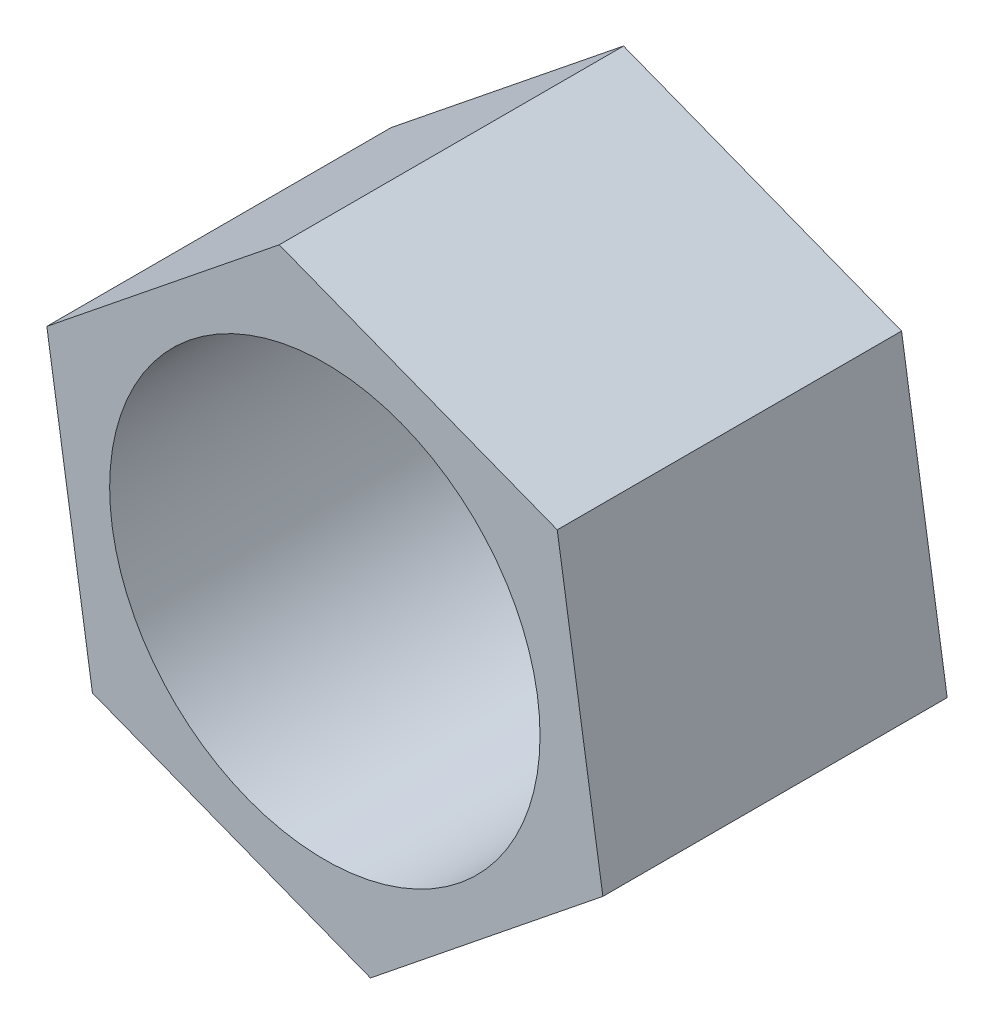
from build123d import *

# Parameters (mm, degrees)
SKETCH1_R           = 2.5
BOSS_EXTRUDE1_DEPTH = 4


with BuildPart() as part:
    # Sketch1 → Boss-Extrude1 (new body)
    with BuildSketch(Plane.XY):
        Polygon((-0.529815097, 3.423345726), (-3.229611914, 1.25283953), (-2.699796817, -2.170506197), (0.529815097, -3.423345726), (3.229611914, -1.25283953), (2.699796817, 2.170506197), align=None)
        Circle(SKETCH1_R, mode=Mode.SUBTRACT)
    extrude(amount=BOSS_EXTRUDE1_DEPTH)


solid = part.part
